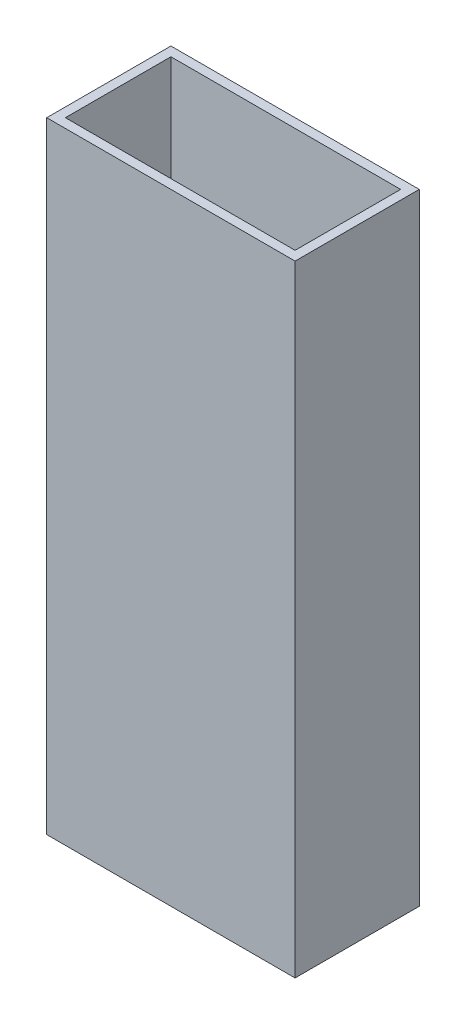
from build123d import *

# Parameters (mm, degrees)
SKETCH1_W           = 40
SKETCH1_H           = 20
SKETCH1_W_2         = 37
SKETCH1_H_2         = 17
BOSS_EXTRUDE1_DEPTH = 100


with BuildPart() as part:
    # Sketch1 → Boss-Extrude1 (new body)
    with BuildSketch(Plane(origin=(0, 0, 0), x_dir=(1, 0, 0), z_dir=(0, 1, 0))):
        Rectangle(SKETCH1_W, SKETCH1_H)
        Rectangle(SKETCH1_W_2, SKETCH1_H_2, mode=Mode.SUBTRACT)
    extrude(amount=BOSS_EXTRUDE1_DEPTH)


solid = part.part
